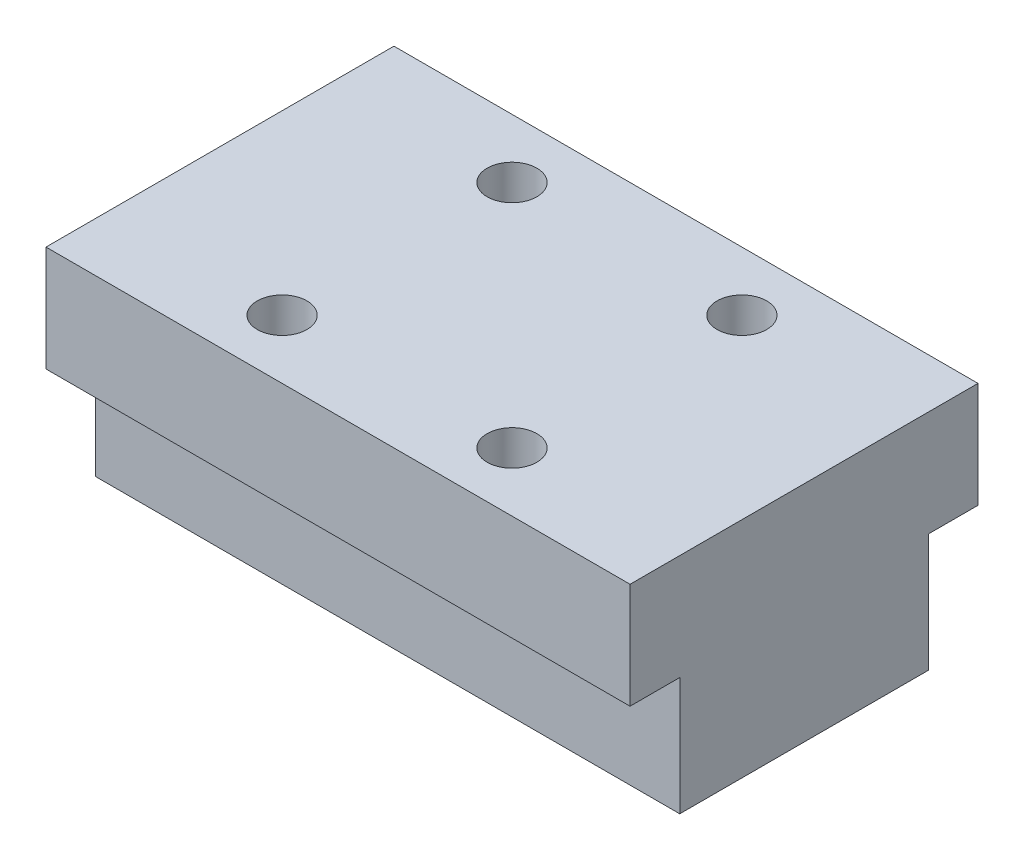
from build123d import *

# Parameters (mm, degrees)
SKETCH_1_W          = 20
SKETCH_1_H          = 9.5
EXTRUDE_1_DEPTH     = 47
SKETCH_2_W          = 47
SKETCH_2_H          = 20
SKETCH_2_H_2        = 4
EXTRUDE_2_DEPTH     = 8.5
SKETCH_3_R          = 2
CUT_EXTRUDE_1_DEPTH = 8.5


with BuildPart() as part:
    # 草图1 → 凸台-拉伸1 (new body)
    with BuildSketch(Plane(origin=(0, 0, 0), x_dir=(0, 0, -1), z_dir=(1, 0, 0))):
        Rectangle(SKETCH_1_W, SKETCH_1_H)
    extrude(amount=EXTRUDE_1_DEPTH)

    # 草图2 → 凸台-拉伸2 (add)
    with BuildSketch(Plane(origin=(0, 4.75, 0), x_dir=(1, 0, 0), z_dir=(0, 1, 0))):
        with Locations((23.5, 0)):
            Rectangle(SKETCH_2_W, SKETCH_2_H)
        with Locations((23.5, 12)):
            Rectangle(SKETCH_2_W, SKETCH_2_H_2)
        with Locations((23.5, -12)):
            Rectangle(SKETCH_2_W, SKETCH_2_H_2)
    extrude(amount=EXTRUDE_2_DEPTH)

    # 草图3 → 切除-拉伸1 (cut)
    with BuildSketch(Plane(origin=(0, 13.25, 0), x_dir=(1, 0, 0), z_dir=(0, 1, 0))):
        with Locations(Location((14.25, 9.25, 0), (0, 0, 270))):
            Circle(SKETCH_3_R)
        with Locations(Location((32.75, 9.25, 0), (0, 0, 22.024312837))):
            Circle(SKETCH_3_R)
        with Locations(Location((32.75, -9.25, 0), (0, 0, 270))):
            Circle(SKETCH_3_R)
        with Locations(Location((14.25, -9.25, 0), (0, 0, 337.975687163))):
            Circle(SKETCH_3_R)
    extrude(amount=-CUT_EXTRUDE_1_DEPTH, mode=Mode.SUBTRACT)


solid = part.part
